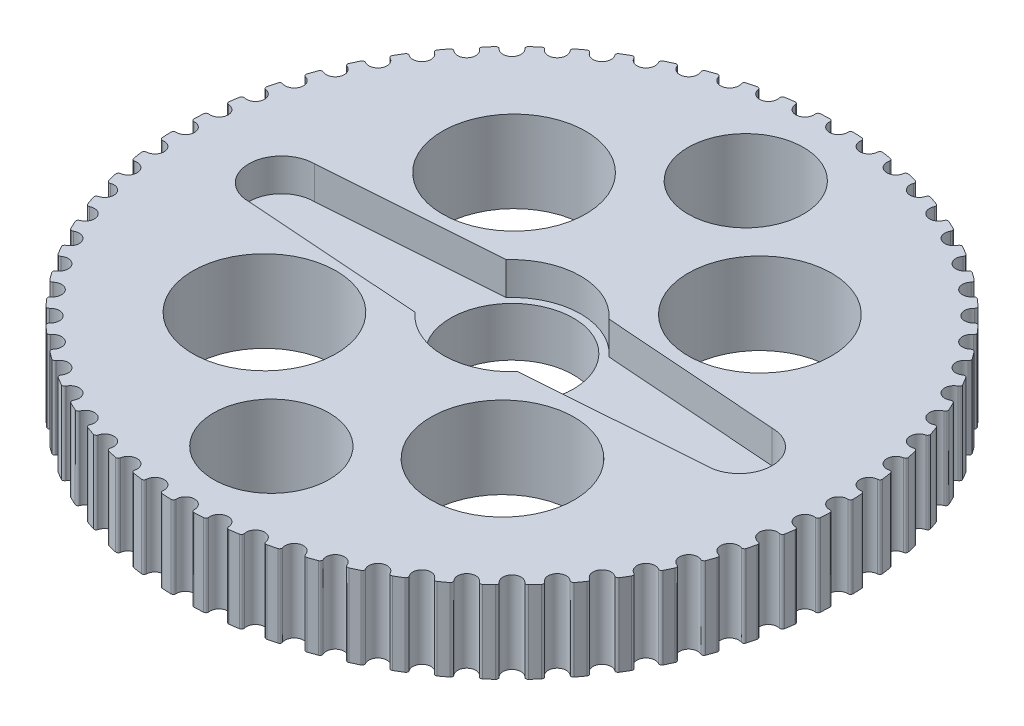
from build123d import *

# Parameters (mm, degrees)
BOSS_EXTRUDE1_DEPTH = 5
CUT_EXTRUDE2_DEPTH  = 2
SKETCH4_R           = 3.75
CUT_EXTRUDE3_DEPTH  = 3
SKETCH5_R           = 4.376753858
SKETCH5_R_2         = 3.524775443
CUT_EXTRUDE4_DEPTH  = 29.872641371


with BuildPart() as part:
    # Sketch1 → Boss-Extrude1 (new body)
    with BuildSketch(Plane(origin=(0, 0, 0), x_dir=(1, 0, 0), z_dir=(0, 1, 0))):
        with BuildLine():
            ThreePointArc((1.264758152, 20.080208834), (0.987241607, 20.095764579), (0.709536651, 20.107485117))
            ThreePointArc((0.709536651, 20.107485117), (0.597601495, 20.063061902), (0.554407106, 19.950646841))
            ThreePointArc((0.554407106, 19.950646841), (0.40140939, 19.54173051), (0, 19.37))
            ThreePointArc((0, 19.37), (-0.40140939, 19.54173051), (-0.554407106, 19.950646841))
            ThreePointArc((-0.554407106, 19.950646841), (-0.597601495, 20.063061902), (-0.709536651, 20.107485117))
            ThreePointArc((-0.709536651, 20.107485117), (-0.987241607, 20.095764579), (-1.264758152, 20.080208834))
            ThreePointArc((-1.264758152, 20.080208834), (-1.371800073, 20.025027964), (-1.403767866, 19.908920422))
            ThreePointArc((-1.403767866, 19.908920422), (-1.515948048, 19.486976737), (-1.898592008, 19.276728156))
            ThreePointArc((-1.898592008, 19.276728156), (-2.314901036, 19.408286736), (-2.507242836, 19.800237624))
            ThreePointArc((-2.507242836, 19.800237624), (-2.561247834, 19.907877585), (-2.676998228, 19.941115327))
            ThreePointArc((-2.676998228, 19.941115327), (-2.952217146, 19.90223138), (-3.226872643, 19.859549163))
            ThreePointArc((-3.226872643, 19.859549163), (-3.327990457, 19.794142061), (-3.348423787, 19.675460217))
            ThreePointArc((-3.348423787, 19.675460217), (-3.418706077, 19.244552725), (-3.778899537, 18.997810881))
            ThreePointArc((-3.778899537, 18.997810881), (-4.206098919, 19.087930551), (-4.435932446, 19.459141295))
            ThreePointArc((-4.435932446, 19.459141295), (-4.500227957, 19.560969525), (-4.61867885, 19.582701695))
            ThreePointArc((-4.61867885, 19.582701695), (-4.88876122, 19.517028814), (-5.157910587, 19.447631177))
            ThreePointArc((-5.157910587, 19.447631177), (-5.252130474, 19.372627749), (-5.260832557, 19.252514574))
            ThreePointArc((-5.260832557, 19.252514574), (-5.288540098, 18.81679315), (-5.622814198, 18.535934303))
            ThreePointArc((-5.622814198, 18.535934303), (-6.05678977, 18.58374716), (-6.321901602, 18.930642798))
            ThreePointArc((-6.321901602, 18.930642798), (-6.395868424, 19.025678635), (-6.515879069, 19.035695941))
            ThreePointArc((-6.515879069, 19.035695941), (-6.77822385, 18.943866591), (-7.039275031, 18.848421871))
            ThreePointArc((-7.039275031, 18.848421871), (-7.125689602, 18.764544442), (-7.122576633, 18.644156691))
            ThreePointArc((-7.122576633, 18.644156691), (-7.107442587, 18.207817571), (-7.412578085, 17.895546545))
            ThreePointArc((-7.412578085, 17.895546545), (-7.849150425, 17.900592125), (-8.146987389, 18.219831862))
            ThreePointArc((-8.146987389, 18.219831862), (-8.229913182, 18.307160059), (-8.35032781, 18.305366029))
            ThreePointArc((-8.35032781, 18.305366029), (-8.60240848, 18.188264578), (-8.85284741, 18.067691959))
            ThreePointArc((-8.85284741, 18.067691959), (-8.930624445, 17.975748314), (-8.915726402, 17.856245387))
            ThreePointArc((-8.915726402, 17.856245387), (-8.857896518, 17.423490756), (-9.130954792, 17.08281489))
            ThreePointArc((-9.130954792, 17.08281489), (-9.565919471, 17.045044603), (-9.893613234, 17.333553985))
            ThreePointArc((-9.893613234, 17.333553985), (-9.984699377, 17.412333524), (-10.10435833, 17.398745436))
            ThreePointArc((-10.10435833, 17.398745436), (-10.343747213, 17.257499633), (-10.581162028, 17.112960297))
            ThreePointArc((-10.581162028, 17.112960297), (-10.649552492, 17.013835903), (-10.623012852, 16.896368679))
            ThreePointArc((-10.623012852, 16.896368679), (-10.523044063, 16.471366199), (-10.761395414, 16.10556639))
            ThreePointArc((-10.761395414, 16.10556639), (-11.190563483, 16.025343983), (-11.544958176, 16.280344508))
            ThreePointArc((-11.544958176, 16.280344508), (-11.643327459, 16.349816699), (-11.761078356, 16.324565412))
            ThreePointArc((-11.761078356, 16.324565412), (-11.985470006, 16.160535533), (-12.207574272, 15.993421473))
            ThreePointArc((-12.207574272, 15.993421473), (-12.265919528, 15.888070952), (-12.227993882, 15.773770704))
            ThreePointArc((-12.227993882, 15.773770704), (-12.086848942, 15.360613382), (-12.288197914, 14.973212482))
            ThreePointArc((-12.288197914, 14.973212482), (-12.707436251, 14.85131054), (-13.085118859, 15.070346414))
            ThreePointArc((-13.085118859, 15.070346414), (-13.189823933, 15.129842201), (-13.304532768, 15.0931709))
            ThreePointArc((-13.304532768, 15.0931709), (-13.511766172, 14.907936642), (-13.716420902, 14.719857256))
            ThreePointArc((-13.716420902, 14.719857256), (-13.764159052, 14.609295192), (-13.715212646, 14.499262694))
            ThreePointArc((-13.715212646, 14.499262694), (-13.534250858, 14.101929462), (-13.696658352, 13.696658352))
            ThreePointArc((-13.696658352, 13.696658352), (-14.101929462, 13.534250858), (-14.499262694, 13.715212646))
            ThreePointArc((-14.499262694, 13.715212646), (-14.609295192, 13.764159052), (-14.719857256, 13.716420902))
            ThreePointArc((-14.719857256, 13.716420902), (-14.907936642, 13.511766172), (-15.0931709, 13.304532768))
            ThreePointArc((-15.0931709, 13.304532768), (-15.129842201, 13.189823933), (-15.070346414, 13.085118859))
            ThreePointArc((-15.070346414, 13.085118859), (-14.85131054, 12.707436251), (-14.973212482, 12.288197914))
            ThreePointArc((-14.973212482, 12.288197914), (-15.360613382, 12.086848942), (-15.773770704, 12.227993882))
            ThreePointArc((-15.773770704, 12.227993882), (-15.888070952, 12.265919528), (-15.993421473, 12.207574272))
            ThreePointArc((-15.993421473, 12.207574272), (-16.160535533, 11.985470006), (-16.324565412, 11.761078356))
            ThreePointArc((-16.324565412, 11.761078356), (-16.349816699, 11.643327459), (-16.280344508, 11.544958176))
            ThreePointArc((-16.280344508, 11.544958176), (-16.025343983, 11.190563483), (-16.10556639, 10.761395414))
            ThreePointArc((-16.10556639, 10.761395414), (-16.471366199, 10.523044063), (-16.896368679, 10.623012852))
            ThreePointArc((-16.896368679, 10.623012852), (-17.013835903, 10.649552492), (-17.112960297, 10.581162028))
            ThreePointArc((-17.112960297, 10.581162028), (-17.257499633, 10.343747213), (-17.398745436, 10.10435833))
            ThreePointArc((-17.398745436, 10.10435833), (-17.412333524, 9.984699377), (-17.333553985, 9.893613234))
            ThreePointArc((-17.333553985, 9.893613234), (-17.045044603, 9.565919471), (-17.08281489, 9.130954792))
            ThreePointArc((-17.08281489, 9.130954792), (-17.423490756, 8.857896518), (-17.856245387, 8.915726402))
            ThreePointArc((-17.856245387, 8.915726402), (-17.975748314, 8.930624445), (-18.067691959, 8.85284741))
            ThreePointArc((-18.067691959, 8.85284741), (-18.188264578, 8.60240848), (-18.305366029, 8.35032781))
            ThreePointArc((-18.305366029, 8.35032781), (-18.307160059, 8.229913182), (-18.219831862, 8.146987389))
            ThreePointArc((-18.219831862, 8.146987389), (-17.900592125, 7.849150425), (-17.895546545, 7.412578085))
            ThreePointArc((-17.895546545, 7.412578085), (-18.207817571, 7.107442587), (-18.644156691, 7.122576633))
            ThreePointArc((-18.644156691, 7.122576633), (-18.764544442, 7.125689602), (-18.848421871, 7.039275031))
            ThreePointArc((-18.848421871, 7.039275031), (-18.943866591, 6.77822385), (-19.035695941, 6.515879069))
            ThreePointArc((-19.035695941, 6.515879069), (-19.025678635, 6.395868424), (-18.930642798, 6.321901602))
            ThreePointArc((-18.930642798, 6.321901602), (-18.58374716, 6.05678977), (-18.535934303, 5.622814198))
            ThreePointArc((-18.535934303, 5.622814198), (-18.81679315, 5.288540098), (-19.252514574, 5.260832557))
            ThreePointArc((-19.252514574, 5.260832557), (-19.372627749, 5.252130474), (-19.447631177, 5.157910587))
            ThreePointArc((-19.447631177, 5.157910587), (-19.517028814, 4.88876122), (-19.582701695, 4.61867885))
            ThreePointArc((-19.582701695, 4.61867885), (-19.560969525, 4.500227957), (-19.459141295, 4.435932446))
            ThreePointArc((-19.459141295, 4.435932446), (-19.087930551, 4.206098919), (-18.997810881, 3.778899537))
            ThreePointArc((-18.997810881, 3.778899537), (-19.244552725, 3.418706077), (-19.675460217, 3.348423787))
            ThreePointArc((-19.675460217, 3.348423787), (-19.794142061, 3.327990457), (-19.859549163, 3.226872643))
            ThreePointArc((-19.859549163, 3.226872643), (-19.90223138, 2.952217146), (-19.941115327, 2.676998228))
            ThreePointArc((-19.941115327, 2.676998228), (-19.907877585, 2.561247834), (-19.800237624, 2.507242836))
            ThreePointArc((-19.800237624, 2.507242836), (-19.408286736, 2.314901036), (-19.276728156, 1.898592008))
            ThreePointArc((-19.276728156, 1.898592008), (-19.486976737, 1.515948048), (-19.908920422, 1.403767866))
            ThreePointArc((-19.908920422, 1.403767866), (-20.025027964, 1.371800073), (-20.080208834, 1.264758152))
            ThreePointArc((-20.080208834, 1.264758152), (-20.095764579, 0.987241607), (-20.107485117, 0.709536651))
            ThreePointArc((-20.107485117, 0.709536651), (-20.063061902, 0.597601495), (-19.950646841, 0.554407106))
            ThreePointArc((-19.950646841, 0.554407106), (-19.54173051, 0.40140939), (-19.37, 0))
            ThreePointArc((-19.37, 0), (-19.54173051, -0.40140939), (-19.950646841, -0.554407106))
            ThreePointArc((-19.950646841, -0.554407106), (-20.063061902, -0.597601495), (-20.107485117, -0.709536651))
            ThreePointArc((-20.107485117, -0.709536651), (-20.095764579, -0.987241607), (-20.080208834, -1.264758152))
            ThreePointArc((-20.080208834, -1.264758152), (-20.025027964, -1.371800073), (-19.908920422, -1.403767866))
            ThreePointArc((-19.908920422, -1.403767866), (-19.486976737, -1.515948048), (-19.276728156, -1.898592008))
            ThreePointArc((-19.276728156, -1.898592008), (-19.408286736, -2.314901036), (-19.800237624, -2.507242836))
            ThreePointArc((-19.800237624, -2.507242836), (-19.907877585, -2.561247834), (-19.941115327, -2.676998228))
            ThreePointArc((-19.941115327, -2.676998228), (-19.90223138, -2.952217146), (-19.859549163, -3.226872643))
            ThreePointArc((-19.859549163, -3.226872643), (-19.794142061, -3.327990457), (-19.675460217, -3.348423787))
            ThreePointArc((-19.675460217, -3.348423787), (-19.244552725, -3.418706077), (-18.997810881, -3.778899537))
            ThreePointArc((-18.997810881, -3.778899537), (-19.087930551, -4.206098919), (-19.459141295, -4.435932446))
            ThreePointArc((-19.459141295, -4.435932446), (-19.560969525, -4.500227957), (-19.582701695, -4.61867885))
            ThreePointArc((-19.582701695, -4.61867885), (-19.517028814, -4.88876122), (-19.447631177, -5.157910587))
            ThreePointArc((-19.447631177, -5.157910587), (-19.372627749, -5.252130474), (-19.252514574, -5.260832557))
            ThreePointArc((-19.252514574, -5.260832557), (-18.81679315, -5.288540098), (-18.535934303, -5.622814198))
            ThreePointArc((-18.535934303, -5.622814198), (-18.58374716, -6.05678977), (-18.930642798, -6.321901602))
            ThreePointArc((-18.930642798, -6.321901602), (-19.025678635, -6.395868424), (-19.035695941, -6.515879069))
            ThreePointArc((-19.035695941, -6.515879069), (-18.943866591, -6.77822385), (-18.848421871, -7.039275031))
            ThreePointArc((-18.848421871, -7.039275031), (-18.764544442, -7.125689602), (-18.644156691, -7.122576633))
            ThreePointArc((-18.644156691, -7.122576633), (-18.207817571, -7.107442587), (-17.895546545, -7.412578085))
            ThreePointArc((-17.895546545, -7.412578085), (-17.900592125, -7.849150425), (-18.219831862, -8.146987389))
            ThreePointArc((-18.219831862, -8.146987389), (-18.307160059, -8.229913182), (-18.305366029, -8.35032781))
            ThreePointArc((-18.305366029, -8.35032781), (-18.188264578, -8.60240848), (-18.067691959, -8.85284741))
            ThreePointArc((-18.067691959, -8.85284741), (-17.975748314, -8.930624445), (-17.856245387, -8.915726402))
            ThreePointArc((-17.856245387, -8.915726402), (-17.423490756, -8.857896518), (-17.08281489, -9.130954792))
            ThreePointArc((-17.08281489, -9.130954792), (-17.045044603, -9.565919471), (-17.333553985, -9.893613234))
            ThreePointArc((-17.333553985, -9.893613234), (-17.412333524, -9.984699377), (-17.398745436, -10.10435833))
            ThreePointArc((-17.398745436, -10.10435833), (-17.257499633, -10.343747213), (-17.112960297, -10.581162028))
            ThreePointArc((-17.112960297, -10.581162028), (-17.013835903, -10.649552492), (-16.896368679, -10.623012852))
            ThreePointArc((-16.896368679, -10.623012852), (-16.471366199, -10.523044063), (-16.10556639, -10.761395414))
            ThreePointArc((-16.10556639, -10.761395414), (-16.025343983, -11.190563483), (-16.280344508, -11.544958176))
            ThreePointArc((-16.280344508, -11.544958176), (-16.349816699, -11.643327459), (-16.324565412, -11.761078356))
            ThreePointArc((-16.324565412, -11.761078356), (-16.160535533, -11.985470006), (-15.993421473, -12.207574272))
            ThreePointArc((-15.993421473, -12.207574272), (-15.888070952, -12.265919528), (-15.773770704, -12.227993882))
            ThreePointArc((-15.773770704, -12.227993882), (-15.360613382, -12.086848942), (-14.973212482, -12.288197914))
            ThreePointArc((-14.973212482, -12.288197914), (-14.85131054, -12.707436251), (-15.070346414, -13.085118859))
            ThreePointArc((-15.070346414, -13.085118859), (-15.129842201, -13.189823933), (-15.0931709, -13.304532768))
            ThreePointArc((-15.0931709, -13.304532768), (-14.907936642, -13.511766172), (-14.719857256, -13.716420902))
            ThreePointArc((-14.719857256, -13.716420902), (-14.609295192, -13.764159052), (-14.499262694, -13.715212646))
            ThreePointArc((-14.499262694, -13.715212646), (-14.101929462, -13.534250858), (-13.696658352, -13.696658352))
            ThreePointArc((-13.696658352, -13.696658352), (-13.534250858, -14.101929462), (-13.715212646, -14.499262694))
            ThreePointArc((-13.715212646, -14.499262694), (-13.764159052, -14.609295192), (-13.716420902, -14.719857256))
            ThreePointArc((-13.716420902, -14.719857256), (-13.511766172, -14.907936642), (-13.304532768, -15.0931709))
            ThreePointArc((-13.304532768, -15.0931709), (-13.189823933, -15.129842201), (-13.085118859, -15.070346414))
            ThreePointArc((-13.085118859, -15.070346414), (-12.707436251, -14.85131054), (-12.288197914, -14.973212482))
            ThreePointArc((-12.288197914, -14.973212482), (-12.086848942, -15.360613382), (-12.227993882, -15.773770704))
            ThreePointArc((-12.227993882, -15.773770704), (-12.265919528, -15.888070952), (-12.207574272, -15.993421473))
            ThreePointArc((-12.207574272, -15.993421473), (-11.985470006, -16.160535533), (-11.761078356, -16.324565412))
            ThreePointArc((-11.761078356, -16.324565412), (-11.643327459, -16.349816699), (-11.544958176, -16.280344508))
            ThreePointArc((-11.544958176, -16.280344508), (-11.190563483, -16.025343983), (-10.761395414, -16.10556639))
            ThreePointArc((-10.761395414, -16.10556639), (-10.523044063, -16.471366199), (-10.623012852, -16.896368679))
            ThreePointArc((-10.623012852, -16.896368679), (-10.649552492, -17.013835903), (-10.581162028, -17.112960297))
            ThreePointArc((-10.581162028, -17.112960297), (-10.343747213, -17.257499633), (-10.10435833, -17.398745436))
            ThreePointArc((-10.10435833, -17.398745436), (-9.984699377, -17.412333524), (-9.893613234, -17.333553985))
            ThreePointArc((-9.893613234, -17.333553985), (-9.565919471, -17.045044603), (-9.130954792, -17.08281489))
            ThreePointArc((-9.130954792, -17.08281489), (-8.857896518, -17.423490756), (-8.915726402, -17.856245387))
            ThreePointArc((-8.915726402, -17.856245387), (-8.930624445, -17.975748314), (-8.85284741, -18.067691959))
            ThreePointArc((-8.85284741, -18.067691959), (-8.60240848, -18.188264578), (-8.35032781, -18.305366029))
            ThreePointArc((-8.35032781, -18.305366029), (-8.229913182, -18.307160059), (-8.146987389, -18.219831862))
            ThreePointArc((-8.146987389, -18.219831862), (-7.849150425, -17.900592125), (-7.412578085, -17.895546545))
            ThreePointArc((-7.412578085, -17.895546545), (-7.107442587, -18.207817571), (-7.122576633, -18.644156691))
            ThreePointArc((-7.122576633, -18.644156691), (-7.125689602, -18.764544442), (-7.039275031, -18.848421871))
            ThreePointArc((-7.039275031, -18.848421871), (-6.77822385, -18.943866591), (-6.515879069, -19.035695941))
            ThreePointArc((-6.515879069, -19.035695941), (-6.395868424, -19.025678635), (-6.321901602, -18.930642798))
            ThreePointArc((-6.321901602, -18.930642798), (-6.05678977, -18.58374716), (-5.622814198, -18.535934303))
            ThreePointArc((-5.622814198, -18.535934303), (-5.288540098, -18.81679315), (-5.260832557, -19.252514574))
            ThreePointArc((-5.260832557, -19.252514574), (-5.252130474, -19.372627749), (-5.157910587, -19.447631177))
            ThreePointArc((-5.157910587, -19.447631177), (-4.88876122, -19.517028814), (-4.61867885, -19.582701695))
            ThreePointArc((-4.61867885, -19.582701695), (-4.500227957, -19.560969525), (-4.435932446, -19.459141295))
            ThreePointArc((-4.435932446, -19.459141295), (-4.206098919, -19.087930551), (-3.778899537, -18.997810881))
            ThreePointArc((-3.778899537, -18.997810881), (-3.418706077, -19.244552725), (-3.348423787, -19.675460217))
            ThreePointArc((-3.348423787, -19.675460217), (-3.327990457, -19.794142061), (-3.226872643, -19.859549163))
            ThreePointArc((-3.226872643, -19.859549163), (-2.952217146, -19.90223138), (-2.676998228, -19.941115327))
            ThreePointArc((-2.676998228, -19.941115327), (-2.561247834, -19.907877585), (-2.507242836, -19.800237624))
            ThreePointArc((-2.507242836, -19.800237624), (-2.314901036, -19.408286736), (-1.898592008, -19.276728156))
            ThreePointArc((-1.898592008, -19.276728156), (-1.515948048, -19.486976737), (-1.403767866, -19.908920422))
            ThreePointArc((-1.403767866, -19.908920422), (-1.371800073, -20.025027964), (-1.264758152, -20.080208834))
            ThreePointArc((-1.264758152, -20.080208834), (-0.987241607, -20.095764579), (-0.709536651, -20.107485117))
            ThreePointArc((-0.709536651, -20.107485117), (-0.597601495, -20.063061902), (-0.554407106, -19.950646841))
            ThreePointArc((-0.554407106, -19.950646841), (-0.40140939, -19.54173051), (0, -19.37))
            ThreePointArc((0, -19.37), (0.40140939, -19.54173051), (0.554407106, -19.950646841))
            ThreePointArc((0.554407106, -19.950646841), (0.597601495, -20.063061902), (0.709536651, -20.107485117))
            ThreePointArc((0.709536651, -20.107485117), (0.987241607, -20.095764579), (1.264758152, -20.080208834))
            ThreePointArc((1.264758152, -20.080208834), (1.371800073, -20.025027964), (1.403767866, -19.908920422))
            ThreePointArc((1.403767866, -19.908920422), (1.515948048, -19.486976737), (1.898592008, -19.276728156))
            ThreePointArc((1.898592008, -19.276728156), (2.314901036, -19.408286736), (2.507242836, -19.800237624))
            ThreePointArc((2.507242836, -19.800237624), (2.561247834, -19.907877585), (2.676998228, -19.941115327))
            ThreePointArc((2.676998228, -19.941115327), (2.952217146, -19.90223138), (3.226872643, -19.859549163))
            ThreePointArc((3.226872643, -19.859549163), (3.327990457, -19.794142061), (3.348423787, -19.675460217))
            ThreePointArc((3.348423787, -19.675460217), (3.418706077, -19.244552725), (3.778899537, -18.997810881))
            ThreePointArc((3.778899537, -18.997810881), (4.206098919, -19.087930551), (4.435932446, -19.459141295))
            ThreePointArc((4.435932446, -19.459141295), (4.500227957, -19.560969525), (4.61867885, -19.582701695))
            ThreePointArc((4.61867885, -19.582701695), (4.88876122, -19.517028814), (5.157910587, -19.447631177))
            ThreePointArc((5.157910587, -19.447631177), (5.252130474, -19.372627749), (5.260832557, -19.252514574))
            ThreePointArc((5.260832557, -19.252514574), (5.288540098, -18.81679315), (5.622814198, -18.535934303))
            ThreePointArc((5.622814198, -18.535934303), (6.05678977, -18.58374716), (6.321901602, -18.930642798))
            ThreePointArc((6.321901602, -18.930642798), (6.395868424, -19.025678635), (6.515879069, -19.035695941))
            ThreePointArc((6.515879069, -19.035695941), (6.77822385, -18.943866591), (7.039275031, -18.848421871))
            ThreePointArc((7.039275031, -18.848421871), (7.125689602, -18.764544442), (7.122576633, -18.644156691))
            ThreePointArc((7.122576633, -18.644156691), (7.107442587, -18.207817571), (7.412578085, -17.895546545))
            ThreePointArc((7.412578085, -17.895546545), (7.849150425, -17.900592125), (8.146987389, -18.219831862))
            ThreePointArc((8.146987389, -18.219831862), (8.229913182, -18.307160059), (8.35032781, -18.305366029))
            ThreePointArc((8.35032781, -18.305366029), (8.60240848, -18.188264578), (8.85284741, -18.067691959))
            ThreePointArc((8.85284741, -18.067691959), (8.930624445, -17.975748314), (8.915726402, -17.856245387))
            ThreePointArc((8.915726402, -17.856245387), (8.857896518, -17.423490756), (9.130954792, -17.08281489))
            ThreePointArc((9.130954792, -17.08281489), (9.565919471, -17.045044603), (9.893613234, -17.333553985))
            ThreePointArc((9.893613234, -17.333553985), (9.984699377, -17.412333524), (10.10435833, -17.398745436))
            ThreePointArc((10.10435833, -17.398745436), (10.343747213, -17.257499633), (10.581162028, -17.112960297))
            ThreePointArc((10.581162028, -17.112960297), (10.649552492, -17.013835903), (10.623012852, -16.896368679))
            ThreePointArc((10.623012852, -16.896368679), (10.523044063, -16.471366199), (10.761395414, -16.10556639))
            ThreePointArc((10.761395414, -16.10556639), (11.190563483, -16.025343983), (11.544958176, -16.280344508))
            ThreePointArc((11.544958176, -16.280344508), (11.643327459, -16.349816699), (11.761078356, -16.324565412))
            ThreePointArc((11.761078356, -16.324565412), (11.985470006, -16.160535533), (12.207574272, -15.993421473))
            ThreePointArc((12.207574272, -15.993421473), (12.265919528, -15.888070952), (12.227993882, -15.773770704))
            ThreePointArc((12.227993882, -15.773770704), (12.086848942, -15.360613382), (12.288197914, -14.973212482))
            ThreePointArc((12.288197914, -14.973212482), (12.707436251, -14.85131054), (13.085118859, -15.070346414))
            ThreePointArc((13.085118859, -15.070346414), (13.189823933, -15.129842201), (13.304532768, -15.0931709))
            ThreePointArc((13.304532768, -15.0931709), (13.511766172, -14.907936642), (13.716420902, -14.719857256))
            ThreePointArc((13.716420902, -14.719857256), (13.764159052, -14.609295192), (13.715212646, -14.499262694))
            ThreePointArc((13.715212646, -14.499262694), (13.534250858, -14.101929462), (13.696658352, -13.696658352))
            ThreePointArc((13.696658352, -13.696658352), (14.101929462, -13.534250858), (14.499262694, -13.715212646))
            ThreePointArc((14.499262694, -13.715212646), (14.609295192, -13.764159052), (14.719857256, -13.716420902))
            ThreePointArc((14.719857256, -13.716420902), (14.907936642, -13.511766172), (15.0931709, -13.304532768))
            ThreePointArc((15.0931709, -13.304532768), (15.129842201, -13.189823933), (15.070346414, -13.085118859))
            ThreePointArc((15.070346414, -13.085118859), (14.85131054, -12.707436251), (14.973212482, -12.288197914))
            ThreePointArc((14.973212482, -12.288197914), (15.360613382, -12.086848942), (15.773770704, -12.227993882))
            ThreePointArc((15.773770704, -12.227993882), (15.888070952, -12.265919528), (15.993421473, -12.207574272))
            ThreePointArc((15.993421473, -12.207574272), (16.160535533, -11.985470006), (16.324565412, -11.761078356))
            ThreePointArc((16.324565412, -11.761078356), (16.349816699, -11.643327459), (16.280344508, -11.544958176))
            ThreePointArc((16.280344508, -11.544958176), (16.025343983, -11.190563483), (16.10556639, -10.761395414))
            ThreePointArc((16.10556639, -10.761395414), (16.471366199, -10.523044063), (16.896368679, -10.623012852))
            ThreePointArc((16.896368679, -10.623012852), (17.013835903, -10.649552492), (17.112960297, -10.581162028))
            ThreePointArc((17.112960297, -10.581162028), (17.257499633, -10.343747213), (17.398745436, -10.10435833))
            ThreePointArc((17.398745436, -10.10435833), (17.412333524, -9.984699377), (17.333553985, -9.893613234))
            ThreePointArc((17.333553985, -9.893613234), (17.045044603, -9.565919471), (17.08281489, -9.130954792))
            ThreePointArc((17.08281489, -9.130954792), (17.423490756, -8.857896518), (17.856245387, -8.915726402))
            ThreePointArc((17.856245387, -8.915726402), (17.975748314, -8.930624445), (18.067691959, -8.85284741))
            ThreePointArc((18.067691959, -8.85284741), (18.188264578, -8.60240848), (18.305366029, -8.35032781))
            ThreePointArc((18.305366029, -8.35032781), (18.307160059, -8.229913182), (18.219831862, -8.146987389))
            ThreePointArc((18.219831862, -8.146987389), (17.900592125, -7.849150425), (17.895546545, -7.412578085))
            ThreePointArc((17.895546545, -7.412578085), (18.207817571, -7.107442587), (18.644156691, -7.122576633))
            ThreePointArc((18.644156691, -7.122576633), (18.764544442, -7.125689602), (18.848421871, -7.039275031))
            ThreePointArc((18.848421871, -7.039275031), (18.943866591, -6.77822385), (19.035695941, -6.515879069))
            ThreePointArc((19.035695941, -6.515879069), (19.025678635, -6.395868424), (18.930642798, -6.321901602))
            ThreePointArc((18.930642798, -6.321901602), (18.58374716, -6.05678977), (18.535934303, -5.622814198))
            ThreePointArc((18.535934303, -5.622814198), (18.81679315, -5.288540098), (19.252514574, -5.260832557))
            ThreePointArc((19.252514574, -5.260832557), (19.372627749, -5.252130474), (19.447631177, -5.157910587))
            ThreePointArc((19.447631177, -5.157910587), (19.517028814, -4.88876122), (19.582701695, -4.61867885))
            ThreePointArc((19.582701695, -4.61867885), (19.560969525, -4.500227957), (19.459141295, -4.435932446))
            ThreePointArc((19.459141295, -4.435932446), (19.087930551, -4.206098919), (18.997810881, -3.778899537))
            ThreePointArc((18.997810881, -3.778899537), (19.244552725, -3.418706077), (19.675460217, -3.348423787))
            ThreePointArc((19.675460217, -3.348423787), (19.794142061, -3.327990457), (19.859549163, -3.226872643))
            ThreePointArc((19.859549163, -3.226872643), (19.90223138, -2.952217146), (19.941115327, -2.676998228))
            ThreePointArc((19.941115327, -2.676998228), (19.907877585, -2.561247834), (19.800237624, -2.507242836))
            ThreePointArc((19.800237624, -2.507242836), (19.408286736, -2.314901036), (19.276728156, -1.898592008))
            ThreePointArc((19.276728156, -1.898592008), (19.486976737, -1.515948048), (19.908920422, -1.403767866))
            ThreePointArc((19.908920422, -1.403767866), (20.025027964, -1.371800073), (20.080208834, -1.264758152))
            ThreePointArc((20.080208834, -1.264758152), (20.095764579, -0.987241607), (20.107485117, -0.709536651))
            ThreePointArc((20.107485117, -0.709536651), (20.063061902, -0.597601495), (19.950646841, -0.554407106))
            ThreePointArc((19.950646841, -0.554407106), (19.54173051, -0.40140939), (19.37, 0))
            ThreePointArc((19.37, 0), (19.54173051, 0.40140939), (19.950646841, 0.554407106))
            ThreePointArc((19.950646841, 0.554407106), (20.063061902, 0.597601495), (20.107485117, 0.709536651))
            ThreePointArc((20.107485117, 0.709536651), (20.095764579, 0.987241607), (20.080208834, 1.264758152))
            ThreePointArc((20.080208834, 1.264758152), (20.025027964, 1.371800073), (19.908920422, 1.403767866))
            ThreePointArc((19.908920422, 1.403767866), (19.486976737, 1.515948048), (19.276728156, 1.898592008))
            ThreePointArc((19.276728156, 1.898592008), (19.408286736, 2.314901036), (19.800237624, 2.507242836))
            ThreePointArc((19.800237624, 2.507242836), (19.907877585, 2.561247834), (19.941115327, 2.676998228))
            ThreePointArc((19.941115327, 2.676998228), (19.90223138, 2.952217146), (19.859549163, 3.226872643))
            ThreePointArc((19.859549163, 3.226872643), (19.794142061, 3.327990457), (19.675460217, 3.348423787))
            ThreePointArc((19.675460217, 3.348423787), (19.244552725, 3.418706077), (18.997810881, 3.778899537))
            ThreePointArc((18.997810881, 3.778899537), (19.087930551, 4.206098919), (19.459141295, 4.435932446))
            ThreePointArc((19.459141295, 4.435932446), (19.560969525, 4.500227957), (19.582701695, 4.61867885))
            ThreePointArc((19.582701695, 4.61867885), (19.517028814, 4.88876122), (19.447631177, 5.157910587))
            ThreePointArc((19.447631177, 5.157910587), (19.372627749, 5.252130474), (19.252514574, 5.260832557))
            ThreePointArc((19.252514574, 5.260832557), (18.81679315, 5.288540098), (18.535934303, 5.622814198))
            ThreePointArc((18.535934303, 5.622814198), (18.58374716, 6.05678977), (18.930642798, 6.321901602))
            ThreePointArc((18.930642798, 6.321901602), (19.025678635, 6.395868424), (19.035695941, 6.515879069))
            ThreePointArc((19.035695941, 6.515879069), (18.943866591, 6.77822385), (18.848421871, 7.039275031))
            ThreePointArc((18.848421871, 7.039275031), (18.764544442, 7.125689602), (18.644156691, 7.122576633))
            ThreePointArc((18.644156691, 7.122576633), (18.207817571, 7.107442587), (17.895546545, 7.412578085))
            ThreePointArc((17.895546545, 7.412578085), (17.900592125, 7.849150425), (18.219831862, 8.146987389))
            ThreePointArc((18.219831862, 8.146987389), (18.307160059, 8.229913182), (18.305366029, 8.35032781))
            ThreePointArc((18.305366029, 8.35032781), (18.188264578, 8.60240848), (18.067691959, 8.85284741))
            ThreePointArc((18.067691959, 8.85284741), (17.975748314, 8.930624445), (17.856245387, 8.915726402))
            ThreePointArc((17.856245387, 8.915726402), (17.423490756, 8.857896518), (17.08281489, 9.130954792))
            ThreePointArc((17.08281489, 9.130954792), (17.045044603, 9.565919471), (17.333553985, 9.893613234))
            ThreePointArc((17.333553985, 9.893613234), (17.412333524, 9.984699377), (17.398745436, 10.10435833))
            ThreePointArc((17.398745436, 10.10435833), (17.257499633, 10.343747213), (17.112960297, 10.581162028))
            ThreePointArc((17.112960297, 10.581162028), (17.013835903, 10.649552492), (16.896368679, 10.623012852))
            ThreePointArc((16.896368679, 10.623012852), (16.471366199, 10.523044063), (16.10556639, 10.761395414))
            ThreePointArc((16.10556639, 10.761395414), (16.025343983, 11.190563483), (16.280344508, 11.544958176))
            ThreePointArc((16.280344508, 11.544958176), (16.349816699, 11.643327459), (16.324565412, 11.761078356))
            ThreePointArc((16.324565412, 11.761078356), (16.160535533, 11.985470006), (15.993421473, 12.207574272))
            ThreePointArc((15.993421473, 12.207574272), (15.888070952, 12.265919528), (15.773770704, 12.227993882))
            ThreePointArc((15.773770704, 12.227993882), (15.360613382, 12.086848942), (14.973212482, 12.288197914))
            ThreePointArc((14.973212482, 12.288197914), (14.85131054, 12.707436251), (15.070346414, 13.085118859))
            ThreePointArc((15.070346414, 13.085118859), (15.129842201, 13.189823933), (15.0931709, 13.304532768))
            ThreePointArc((15.0931709, 13.304532768), (14.907936642, 13.511766172), (14.719857256, 13.716420902))
            ThreePointArc((14.719857256, 13.716420902), (14.609295192, 13.764159052), (14.499262694, 13.715212646))
            ThreePointArc((14.499262694, 13.715212646), (14.101929462, 13.534250858), (13.696658352, 13.696658352))
            ThreePointArc((13.696658352, 13.696658352), (13.534250858, 14.101929462), (13.715212646, 14.499262694))
            ThreePointArc((13.715212646, 14.499262694), (13.764159052, 14.609295192), (13.716420902, 14.719857256))
            ThreePointArc((13.716420902, 14.719857256), (13.511766172, 14.907936642), (13.304532768, 15.0931709))
            ThreePointArc((13.304532768, 15.0931709), (13.189823933, 15.129842201), (13.085118859, 15.070346414))
            ThreePointArc((13.085118859, 15.070346414), (12.707436251, 14.85131054), (12.288197914, 14.973212482))
            ThreePointArc((12.288197914, 14.973212482), (12.086848942, 15.360613382), (12.227993882, 15.773770704))
            ThreePointArc((12.227993882, 15.773770704), (12.265919528, 15.888070952), (12.207574272, 15.993421473))
            ThreePointArc((12.207574272, 15.993421473), (11.985470006, 16.160535533), (11.761078356, 16.324565412))
            ThreePointArc((11.761078356, 16.324565412), (11.643327459, 16.349816699), (11.544958176, 16.280344508))
            ThreePointArc((11.544958176, 16.280344508), (11.190563483, 16.025343983), (10.761395414, 16.10556639))
            ThreePointArc((10.761395414, 16.10556639), (10.523044063, 16.471366199), (10.623012852, 16.896368679))
            ThreePointArc((10.623012852, 16.896368679), (10.649552492, 17.013835903), (10.581162028, 17.112960297))
            ThreePointArc((10.581162028, 17.112960297), (10.343747213, 17.257499633), (10.10435833, 17.398745436))
            ThreePointArc((10.10435833, 17.398745436), (9.984699377, 17.412333524), (9.893613234, 17.333553985))
            ThreePointArc((9.893613234, 17.333553985), (9.565919471, 17.045044603), (9.130954792, 17.08281489))
            ThreePointArc((9.130954792, 17.08281489), (8.857896518, 17.423490756), (8.915726402, 17.856245387))
            ThreePointArc((8.915726402, 17.856245387), (8.930624445, 17.975748314), (8.85284741, 18.067691959))
            ThreePointArc((8.85284741, 18.067691959), (8.60240848, 18.188264578), (8.35032781, 18.305366029))
            ThreePointArc((8.35032781, 18.305366029), (8.229913182, 18.307160059), (8.146987389, 18.219831862))
            ThreePointArc((8.146987389, 18.219831862), (7.849150425, 17.900592125), (7.412578085, 17.895546545))
            ThreePointArc((7.412578085, 17.895546545), (7.107442587, 18.207817571), (7.122576633, 18.644156691))
            ThreePointArc((7.122576633, 18.644156691), (7.125689602, 18.764544442), (7.039275031, 18.848421871))
            ThreePointArc((7.039275031, 18.848421871), (6.77822385, 18.943866591), (6.515879069, 19.035695941))
            ThreePointArc((6.515879069, 19.035695941), (6.395868424, 19.025678635), (6.321901602, 18.930642798))
            ThreePointArc((6.321901602, 18.930642798), (6.05678977, 18.58374716), (5.622814198, 18.535934303))
            ThreePointArc((5.622814198, 18.535934303), (5.288540098, 18.81679315), (5.260832557, 19.252514574))
            ThreePointArc((5.260832557, 19.252514574), (5.252130474, 19.372627749), (5.157910587, 19.447631177))
            ThreePointArc((5.157910587, 19.447631177), (4.88876122, 19.517028814), (4.61867885, 19.582701695))
            ThreePointArc((4.61867885, 19.582701695), (4.500227957, 19.560969525), (4.435932446, 19.459141295))
            ThreePointArc((4.435932446, 19.459141295), (4.206098919, 19.087930551), (3.778899537, 18.997810881))
            ThreePointArc((3.778899537, 18.997810881), (3.418706077, 19.244552725), (3.348423787, 19.675460217))
            ThreePointArc((3.348423787, 19.675460217), (3.327990457, 19.794142061), (3.226872643, 19.859549163))
            ThreePointArc((3.226872643, 19.859549163), (2.952217146, 19.90223138), (2.676998228, 19.941115327))
            ThreePointArc((2.676998228, 19.941115327), (2.561247834, 19.907877585), (2.507242836, 19.800237624))
            ThreePointArc((2.507242836, 19.800237624), (2.314901036, 19.408286736), (1.898592008, 19.276728156))
            ThreePointArc((1.898592008, 19.276728156), (1.515948048, 19.486976737), (1.403767866, 19.908920422))
            ThreePointArc((1.403767866, 19.908920422), (1.371800073, 20.025027964), (1.264758152, 20.080208834))
        make_face()
    extrude(amount=BOSS_EXTRUDE1_DEPTH)

    # Sketch2 → Cut-Extrude2 (cut)
    with BuildSketch(Plane(origin=(0, 5, 0), x_dir=(1, 0, 0), z_dir=(0, 1, 0))):
        with BuildLine():
            Line((-3.141265312, -2.775594211), (-14.058542875, -2))
            ThreePointArc((-14.058542875, -2), (-16.058542875, 0), (-14.058542875, 2))
            Line((-14.058542875, 2), (-3.136113737, 2.7814136))
            ThreePointArc((-3.136113737, 2.7814136), (0, 4.191833845), (3.136113737, 2.7814136))
            Line((3.136113737, 2.7814136), (13.862414246, 2))
            ThreePointArc((13.862414246, 2), (15.862414246, 0), (13.862414246, -2))
            Line((13.862414246, -2), (3.141289797, -2.7755665))
            ThreePointArc((3.141289797, -2.7755665), (1.8489e-05, -4.191833845), (-3.141265312, -2.775594211))
        make_face()
    extrude(amount=-CUT_EXTRUDE2_DEPTH, mode=Mode.SUBTRACT)

    # Sketch4 → Cut-Extrude3 (cut)
    with BuildSketch(Plane(origin=(0, 3, 0), x_dir=(1, 0, 0), z_dir=(0, 1, 0))):
        with Locations(Location((0, 0, 0), (0, 0, 270))):
            Circle(SKETCH4_R)
    extrude(amount=-CUT_EXTRUDE3_DEPTH, mode=Mode.SUBTRACT)

    # Sketch5 → Cut-Extrude4 (cut, through all)
    with BuildSketch(Plane(origin=(0, 5, 0), x_dir=(1, 0, 0), z_dir=(0, 1, 0))):
        with Locations(Location((-7.5, 7.62577403, 0), (0, 0, 270))):
            Circle(SKETCH5_R)
        with Locations(Location((7.5, 7.62577403, 0), (0, 0, 90))):
            Circle(SKETCH5_R)
        with Locations(Location((7.259152966, -7.839496404, 0), (0, 0, 270))):
            Circle(SKETCH5_R)
        with Locations(Location((-7.733572863, -7.372407317, 0), (0, 0, 90))):
            Circle(SKETCH5_R)
        with Locations(Location((0, 14.264970157, 0), (0, 0, 270))):
            Circle(SKETCH5_R_2)
        with Locations(Location((-0.443949686, -14.241928345, 0), (0, 0, 90))):
            Circle(SKETCH5_R_2)
    extrude(amount=-CUT_EXTRUDE4_DEPTH, mode=Mode.SUBTRACT)


solid = part.part
